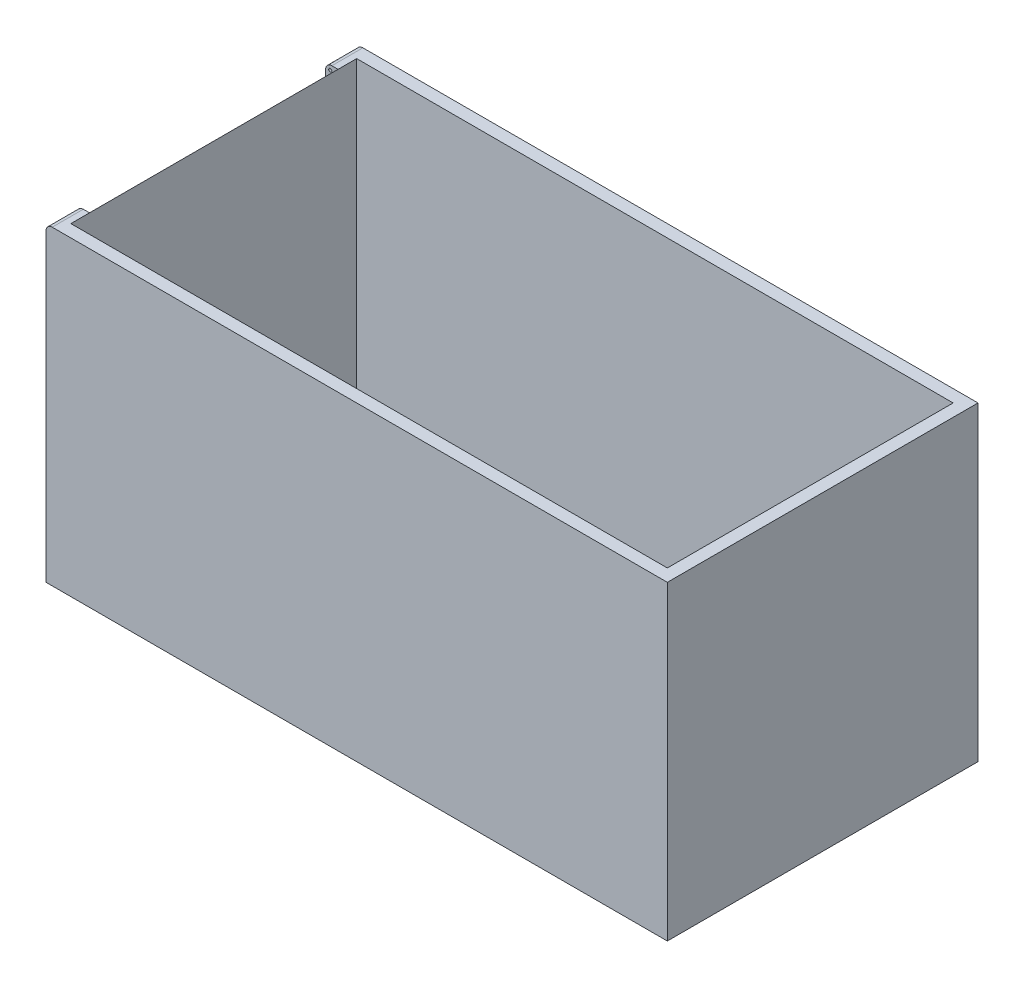
from build123d import *

# Parameters (mm, degrees)
SKETCH2_W               = 127
SKETCH2_H               = 63.5
BOSS_EXTRUDE1_DEPTH     = 63.5
SHELL1_T                = -2.54
CUT_EXTRUDE1_DEPTH      = 25.4
CUT_EXTRUDE1_DEPTH_BACK = 25.4
CUT_EXTRUDE2_DEPTH      = 52.07
CUT_EXTRUDE2_DEPTH_BACK = 1.27
SKETCH5_R               = 0.3175
FILLET1_R               = 1.27


with BuildPart() as part:
    # Sketch2 → Boss-Extrude1 (new body)
    with BuildSketch(Plane(origin=(0, 0, 0), x_dir=(1, 0, 0), z_dir=(0, 1, 0))):
        Rectangle(SKETCH2_W, SKETCH2_H)
    extrude(amount=BOSS_EXTRUDE1_DEPTH)

    # Shell1
    shell1_openings = [part.faces().sort_by_distance(p)[0] for p in [
        (0, 63.5, 0),
    ]]
    offset(amount=SHELL1_T, openings=shell1_openings, kind=Kind.INTERSECTION)

    # Sketch4 → Cut-Extrude1 (cut, two sides: drawn at the far end of the back side and taken through both)
    with BuildSketch(Plane.XY.offset(-CUT_EXTRUDE1_DEPTH_BACK)):
        with BuildLine():
            Line((-60.96, 63.5), (-63.5, 63.5))
            Line((-63.5, 63.5), (-63.5, 60.96))
            ThreePointArc((-63.5, 60.96), (-61.703948776, 61.703948776), (-60.96, 63.5))
        make_face()
    extrude(amount=CUT_EXTRUDE1_DEPTH + CUT_EXTRUDE1_DEPTH_BACK, mode=Mode.SUBTRACT)

    # Sketch5 → Cut-Extrude2 (cut, two sides: drawn at the far end of the back side and taken through both)
    with BuildSketch(Plane.XY.offset(-25.4).offset(-CUT_EXTRUDE2_DEPTH_BACK)):
        with Locations((-62.5475, 62.5475)):
            Circle(SKETCH5_R)
    extrude(amount=CUT_EXTRUDE2_DEPTH + CUT_EXTRUDE2_DEPTH_BACK, mode=Mode.SUBTRACT)

    # Fillet1
    fillet1_edges = [part.edges().sort_by_distance(p)[0] for p in [
        (-63.5, 63.5, -28.575),
        (-63.5, 63.5, 28.575),
    ]]
    fillet(fillet1_edges, radius=FILLET1_R)


solid = part.part
